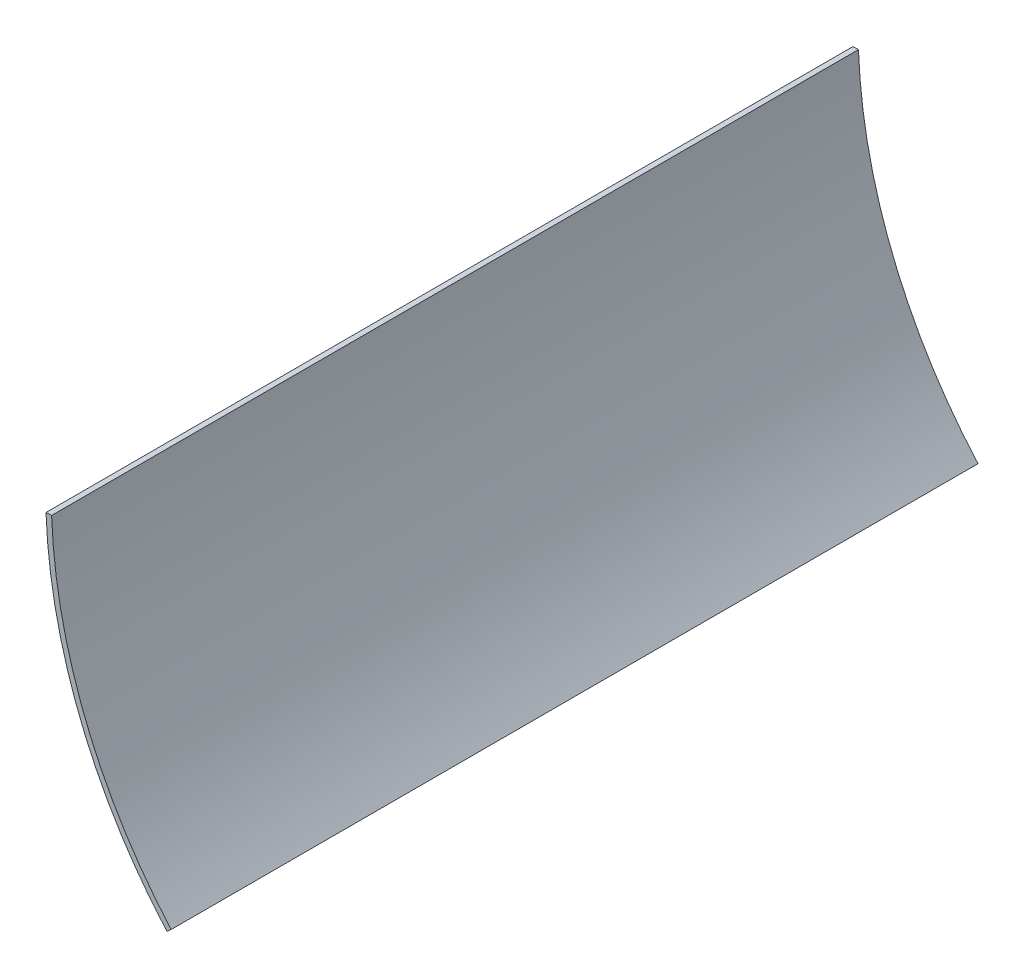
from build123d import *

# Parameters (mm, degrees)
EXTRUDE_THIN1_DEPTH = 342.9
BOSS_EXTRUDE1_START = -203.2
BOSS_EXTRUDE1_DEPTH = 279.4
CUT_EXTRUDE1_START  = -38.1
CUT_EXTRUDE1_DEPTH  = 203.2
CUT_EXTRUDE2_START  = -9.525
SKETCH4_R           = 3.048
CUT_EXTRUDE2_DEPTH  = 19.05
CUT_EXTRUDE3_START  = -28.575
SKETCH5_R           = 3.048
CUT_EXTRUDE3_DEPTH  = 19.05


with BuildPart() as part:
    # Sketch1 → Extrude-Thin1 (new, symmetric)
    with BuildSketch(Plane.XY):
        with BuildLine():
            ThreePointArc((0, 0), (28.7854342, -135.80582632), (101.6, -254))
            Line((101.6, -254), (98.031425453, -257.153836069))
            ThreePointArc((98.031425453, -257.153836069), (24.36356396, -137.574574416), (-4.759199547, -0.177273569))
            Line((-4.759199547, -0.177273569), (0, 0))
        make_face()
    extrude(amount=EXTRUDE_THIN1_DEPTH, both=True)

    # Sketch2 → Boss-Extrude1 (add)
    with BuildSketch(Plane.XY.offset(342.9).offset(BOSS_EXTRUDE1_START)):
        with BuildLine():
            Line((-9.288950239, -72.469656114), (4.395363676, -72.469656114))
            ThreePointArc((4.395363676, -72.469656114), (7.38925865, -85.220570454), (10.787766498, -97.869656114))
            Line((10.787766498, -97.869656114), (-9.288950239, -97.869656114))
            ThreePointArc((-9.288950239, -97.869656114), (-21.988950239, -85.169656114), (-9.288950239, -72.469656114))
        make_face()
    extrude(amount=-BOSS_EXTRUDE1_DEPTH)

    # Sketch3 → Cut-Extrude1 (cut)
    with BuildSketch(Plane.XY.offset(139.7).offset(CUT_EXTRUDE1_START)):
        with BuildLine():
            Line((-9.288950239, -97.869656114), (10.787766498, -97.869656114))
            ThreePointArc((10.787766498, -97.869656114), (7.38925865, -85.220570454), (4.395363676, -72.469656114))
            Line((4.395363676, -72.469656114), (-9.288950239, -72.469656114))
            ThreePointArc((-9.288950239, -72.469656114), (-21.988950239, -85.169656114), (-9.288950239, -97.869656114))
        make_face()
    extrude(amount=-CUT_EXTRUDE1_DEPTH, mode=Mode.SUBTRACT)

    # Sketch4 → Cut-Extrude2 (cut)
    with BuildSketch(Plane.XY.offset(-101.6).offset(CUT_EXTRUDE2_START)):
        with BuildLine():
            ThreePointArc((-9.288950239, -97.869656114), (-0.308694117, -94.149912235), (3.411049761, -85.169656114))
            ThreePointArc((3.411049761, -85.169656114), (-0.308694117, -76.189399993), (-9.288950239, -72.469656114))
            ThreePointArc((-9.288950239, -72.469656114), (-21.988950239, -85.169656114), (-9.288950239, -97.869656114))
        make_face()
        with Locations((-9.288950239, -85.169656114)):
            Circle(SKETCH4_R, mode=Mode.SUBTRACT)
    extrude(amount=-CUT_EXTRUDE2_DEPTH, mode=Mode.SUBTRACT)

    # Sketch5 → Cut-Extrude3 (cut)
    with BuildSketch(Plane(origin=(0, 0, 101.6), x_dir=(-1, 0, 0), z_dir=(0, 0, -1)).offset(CUT_EXTRUDE3_START)):
        with BuildLine():
            ThreePointArc((9.288950239, -97.869656114), (18.26920636, -94.149912235), (21.988950239, -85.169656114))
            ThreePointArc((21.988950239, -85.169656114), (18.26920636, -76.189399993), (9.288950239, -72.469656114))
            ThreePointArc((9.288950239, -72.469656114), (-3.411049761, -85.169656114), (9.288950239, -97.869656114))
        make_face()
        with Locations(Location((9.288950239, -85.169656114, 0), (0, 0, 180))):
            Circle(SKETCH5_R, mode=Mode.SUBTRACT)
    extrude(amount=CUT_EXTRUDE3_DEPTH, mode=Mode.SUBTRACT)


solid = part.part
